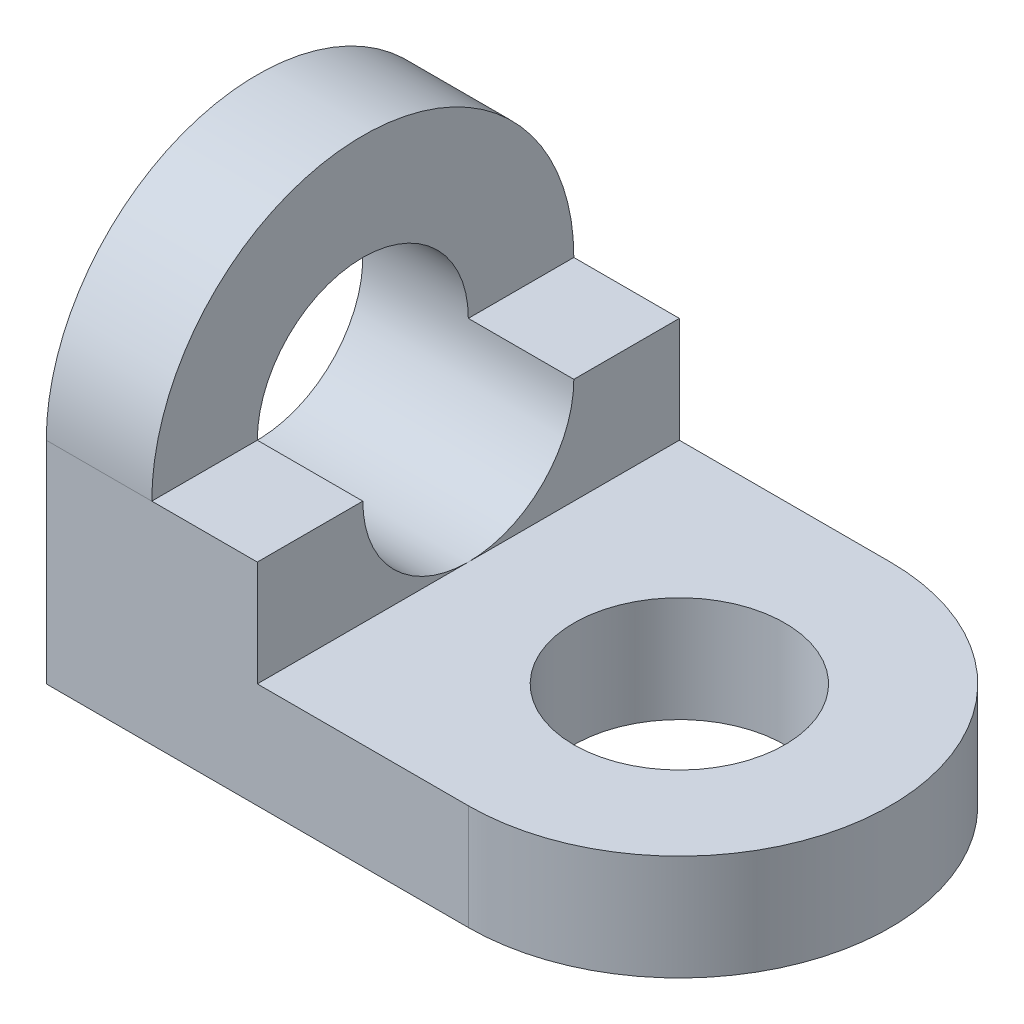
from build123d import *

# Parameters (mm, degrees)
SKETCH_1_R      = 5
EXTRUDE_1_DEPTH = 5
SKETCH_2_R      = 5
EXTRUDE_2_DEPTH = 5
EXTRUDE_3_DEPTH = 5


with BuildPart() as part:
    # 草圖1 → 填料-伸長1 (new body)
    with BuildSketch(Plane(origin=(0, 0, 0), x_dir=(1, 0, 0), z_dir=(0, 1, 0))):
        with BuildLine():
            Line((0, 10), (-20, 10))
            Line((-20, 10), (-20, -10))
            Line((-20, -10), (0, -10))
            ThreePointArc((0, -10), (10, 0), (0, 10))
        make_face()
        with Locations(Location((0, 0, 0), (0, 0, 270))):
            Circle(SKETCH_1_R, mode=Mode.SUBTRACT)
    extrude(amount=EXTRUDE_1_DEPTH)

    # 草圖2 → 填料-伸長2 (add)
    with BuildSketch(Plane.ZY.offset(20)):
        with BuildLine():
            Line((-10, 0), (10, 0))
            Line((10, 0), (10, 10))
            ThreePointArc((10, 10), (0, 20), (-10, 10))
            Line((-10, 10), (-10, 0))
        make_face()
        with Locations((0, 10)):
            Circle(SKETCH_2_R, mode=Mode.SUBTRACT)
    extrude(amount=-EXTRUDE_2_DEPTH)

    # 草圖3 → 填料-伸長3 (add)
    with BuildSketch(Plane(origin=(-15, 0, 0), x_dir=(0, 0, -1), z_dir=(1, 0, 0))):
        with BuildLine():
            Line((-10, 5), (0, 5))
            ThreePointArc((0, 5), (-3.535533906, 6.464466094), (-5, 10))
            Line((-5, 10), (-10, 10))
            Line((-10, 10), (-10, 5))
        make_face()
        with BuildLine():
            ThreePointArc((5, 10), (3.535533906, 6.464466094), (0, 5))
            Line((0, 5), (10, 5))
            Line((10, 5), (10, 10))
            Line((10, 10), (5, 10))
        make_face()
    extrude(amount=EXTRUDE_3_DEPTH)


solid = part.part
